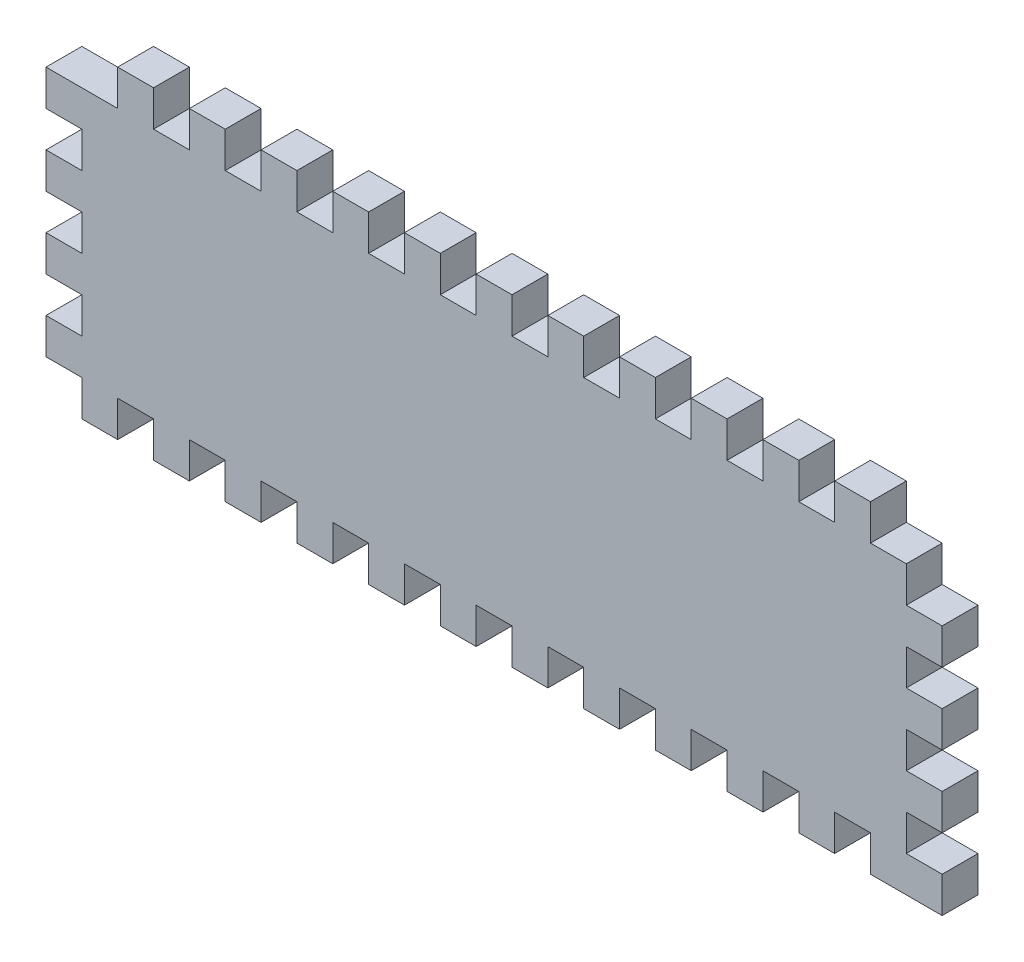
from build123d import *

# Parameters (mm, degrees)
BOSS_EXTRUDE1_DEPTH = 3


with BuildPart() as part:
    # Sketch1 → Boss-Extrude1 (new body)
    with BuildSketch(Plane.XY):
        Polygon((282, 84), (285, 84), (285, 81), (291, 81), (291, 84), (288, 84), (288, 87), (291, 87), (291, 90), (288, 90), (288, 93), (291, 93), (291, 96), (288, 96), (288, 99), (291, 99), (291, 102), (288, 102), (288, 105), (285, 105), (285, 108), (282, 108), (282, 105), (279, 105), (279, 108), (276, 108), (276, 105), (273, 105), (273, 108), (270, 108), (270, 105), (267, 105), (267, 108), (264, 108), (264, 105), (261, 105), (261, 108), (258, 108), (258, 105), (255, 105), (255, 108), (252, 108), (252, 105), (249, 105), (249, 108), (246, 108), (246, 105), (243, 105), (243, 108), (240, 108), (240, 105), (237, 105), (237, 108), (234, 108), (234, 105), (231, 105), (231, 108), (228, 108), (228, 105), (225, 105), (225, 108), (222, 108), (222, 105), (216, 105), (216, 102), (219, 102), (219, 99), (216, 99), (216, 96), (219, 96), (219, 93), (216, 93), (216, 90), (219, 90), (219, 87), (216, 87), (216, 84), (219, 84), (219, 81), (222, 81), (222, 84), (225, 84), (225, 81), (228, 81), (228, 84), (231, 84), (231, 81), (234, 81), (234, 84), (237, 84), (237, 81), (240, 81), (240, 84), (243, 84), (243, 81), (246, 81), (246, 84), (249, 84), (249, 81), (252, 81), (252, 84), (255, 84), (255, 81), (258, 81), (258, 84), (261, 84), (261, 81), (264, 81), (264, 84), (267, 84), (267, 81), (270, 81), (270, 84), (273, 84), (273, 81), (276, 81), (276, 84), (279, 84), (279, 81), (282, 81), align=None)
    extrude(amount=BOSS_EXTRUDE1_DEPTH)


solid = part.part
